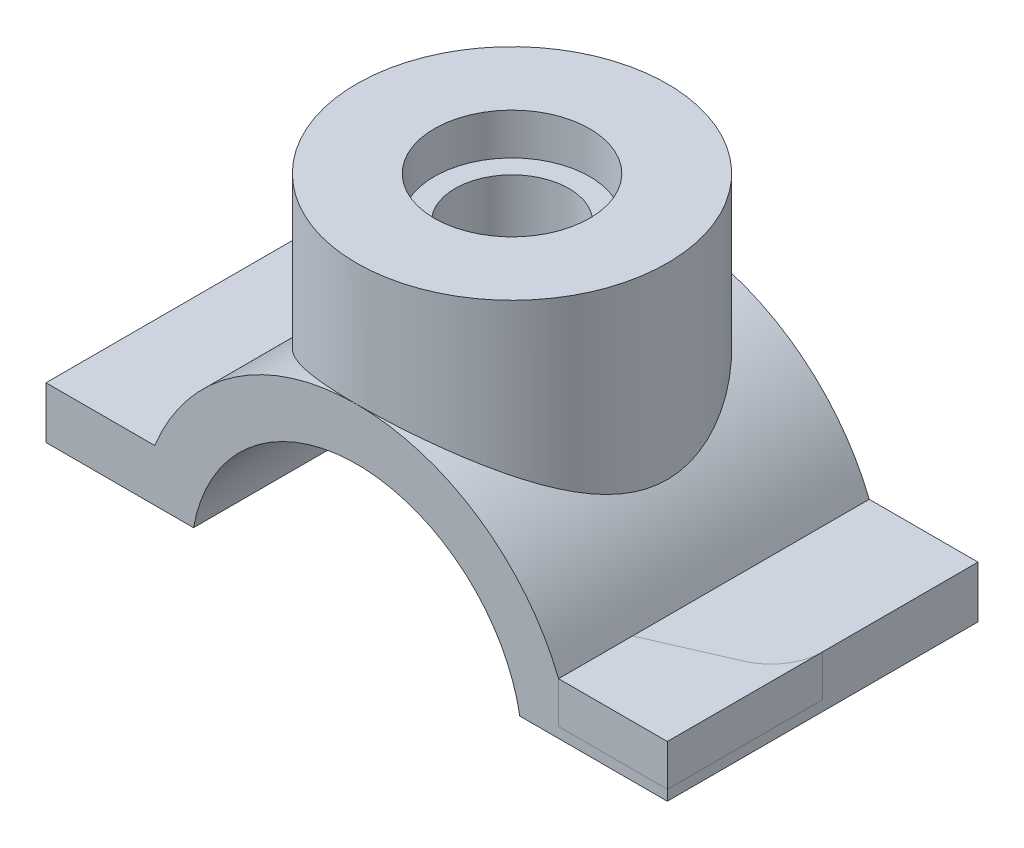
from build123d import *

# Parameters (mm, degrees)
BOSS_EXTRUDE2_DEPTH      = 75
BOSS_EXTRUDE5_REACH      = 240.681
BOSS_EXTRUDE5_END_RADIUS = 105
SKETCH2_R                = 75
SKETCH2_R_2              = 37.5
BOSS_EXTRUDE6_REACH      = 240.681
BOSS_EXTRUDE6_END_RADIUS = 105
SKETCH2_10_R             = 37.5
SKETCH2_10_R_2           = 27.5
SKETCH2_11_R             = 37.5
SKETCH2_11_R_2           = 27.5
CUT_EXTRUDE1_DEPTH       = 20
CUT_EXTRUDE5_DEPTH       = 20
BOSS_EXTRUDE7_DEPTH      = 20
BOSS_EXTRUDE8_DEPTH      = 20


with BuildPart() as part:
    # Sketch1 → Boss-Extrude2 (new, symmetric)
    with BuildSketch(Plane.XY):
        with BuildLine():
            Line((-169.833817009, 0), (-117.322277864, 0))
            ThreePointArc((-117.322277864, 0), (-19.833817009, 66), (77.654643847, 0))
            Line((77.654643847, 0), (130.166182991, 0))
            Line((130.166182991, 0), (130.166182991, -25))
            Line((130.166182991, -25), (58.931657662, -25))
            ThreePointArc((58.931657662, -25), (-19.833817009, 41), (-98.599291679, -25))
            Line((-98.599291679, -25), (-169.833817009, -25))
            Line((-169.833817009, -25), (-169.833817009, 0))
        make_face()
    extrude(amount=BOSS_EXTRUDE2_DEPTH, both=True)

    # Boss-Extrude5: up to this cylinder (the profile starts outside it)
    boss_extrude5_end = Plane(origin=(-19.833817009, -39, -72.87868), z_dir=(0, 0, -1)) * Cylinder(BOSS_EXTRUDE5_END_RADIUS, 692.362, mode=Mode.PRIVATE)
    # Sketch2 → Boss-Extrude5 (add, up to the surface)
    with BuildSketch(Plane(origin=(0, 125, 0), x_dir=(1, 0, 0), z_dir=(0, 1, 0)), mode=Mode.PRIVATE) as boss_extrude5_sk1:
        with Locations(Location((-19.833817009, 0, 0), (0, 0, 270))):
            Circle(SKETCH2_R)
        with Locations(Location((-19.833817009, 0, 0), (0, 0, 270))):
            Circle(SKETCH2_R_2, mode=Mode.SUBTRACT)
    boss_extrude5_tool1 = extrude(boss_extrude5_sk1.sketch, amount=-BOSS_EXTRUDE5_REACH, mode=Mode.PRIVATE) - boss_extrude5_end
    add(boss_extrude5_tool1.solids().sort_by_distance((-19.833817, 125, -72.87868))[0])

    # Boss-Extrude6: up to this cylinder (the profile starts outside it)
    boss_extrude6_end = Plane(origin=(-19.833817009, -39, 0), z_dir=(0, 0, -1)) * Cylinder(BOSS_EXTRUDE6_END_RADIUS, 692.362, mode=Mode.PRIVATE)
    # Sketch2<10> → Boss-Extrude6 (add, up to the surface)
    with BuildSketch(Plane(origin=(0, 125, 0), x_dir=(1, 0, 0), z_dir=(0, 1, 0)), mode=Mode.PRIVATE) as boss_extrude6_sk1:
        with Locations((-19.833817009, 0)):
            Circle(SKETCH2_10_R)
        with Locations(Location((-19.833817009, 0, 0), (0, 0, 270))):
            Circle(SKETCH2_10_R_2, mode=Mode.SUBTRACT)
    boss_extrude6_tool1 = extrude(boss_extrude6_sk1.sketch, amount=-BOSS_EXTRUDE6_REACH, mode=Mode.PRIVATE) - boss_extrude6_end
    add(boss_extrude6_tool1.solids().sort_by_distance((-56.273157, 125, 0))[0])

    # Sketch2<11> → Cut-Extrude1 (cut)
    with BuildSketch(Plane(origin=(0, 125, 0), x_dir=(1, 0, 0), z_dir=(0, 1, 0))):
        with Locations(Location((-19.833817009, 0, 0), (0, 0, 270))):
            Circle(SKETCH2_11_R)
        with Locations(Location((-19.833817009, 0, 0), (0, 0, 270))):
            Circle(SKETCH2_11_R_2, mode=Mode.SUBTRACT)
    extrude(amount=-CUT_EXTRUDE1_DEPTH, mode=Mode.SUBTRACT)

    # Sketch3 → Cut-Extrude5 (cut)
    with BuildSketch(Plane(origin=(0, 0, 0), x_dir=(1, 0, 0), z_dir=(0, 1, 0))):
        with BuildLine():
            Line((77.654643847, -75), (130.166182991, -75))
            Line((130.166182991, -75), (130.166182991, 0))
            ThreePointArc((130.166182991, 0), (126.445873921, -13.121537789), (116.392202675, -22.337781494))
            Line((116.392202675, -22.337781494), (116.276169616, -22.395718278))
            ThreePointArc((116.276169616, -22.395718278), (115.113974639, -22.935593329), (113.925642242, -23.415206034))
            Line((113.925642242, -23.415206034), (77.654643847, -39.258833162))
            Line((77.654643847, -39.258833162), (77.654643847, -75))
        make_face()
        with BuildLine():
            ThreePointArc((113.873176653, 23.434766083), (125.692688314, 14.271039879), (130.166182991, 0))
            Line((130.166182991, 0), (130.166182991, 75))
            Line((130.166182991, 75), (77.654643847, 75))
            Line((77.654643847, 75), (77.654643847, 39.207200347))
            Line((77.654643847, 39.207200347), (113.873176653, 23.434766083))
        make_face()
    extrude(amount=-CUT_EXTRUDE5_DEPTH, mode=Mode.SUBTRACT)

    # Sketch4 → Boss-Extrude7 (add)
    with BuildSketch(Plane(origin=(0, -20, 0), x_dir=(1, 0, 0), z_dir=(0, 1, 0))):
        with BuildLine():
            Line((77.654643847, 75), (77.654643847, 39.207200347))
            Line((77.654643847, 39.207200347), (113.873176653, 23.434766083))
            ThreePointArc((113.873176653, 23.434766083), (125.341873235, 14.027135917), (130.166182991, 0))
            Line((130.166182991, 0), (130.166182991, 75))
            Line((130.166182991, 75), (77.654643847, 75))
        make_face()
    extrude(amount=BOSS_EXTRUDE7_DEPTH)


with BuildPart() as body_2:
    # Sketch5 → Boss-Extrude8 (new body)
    with BuildSketch(Plane(origin=(0, 0, 0), x_dir=(1, 0, 0), z_dir=(0, 1, 0))):
        with BuildLine():
            Line((77.654643847, -39.258833162), (77.654643847, -75))
            Line((77.654643847, -75), (130.166182991, -75))
            Line((130.166182991, -75), (130.166182991, 0))
            ThreePointArc((130.166182991, 0), (125.708657055, -14.248044054), (113.925642242, -23.415206034))
            Line((113.925642242, -23.415206034), (77.654643847, -39.258833162))
        make_face()
    extrude(amount=-BOSS_EXTRUDE8_DEPTH)


solid = Compound([part.part, body_2.part])
